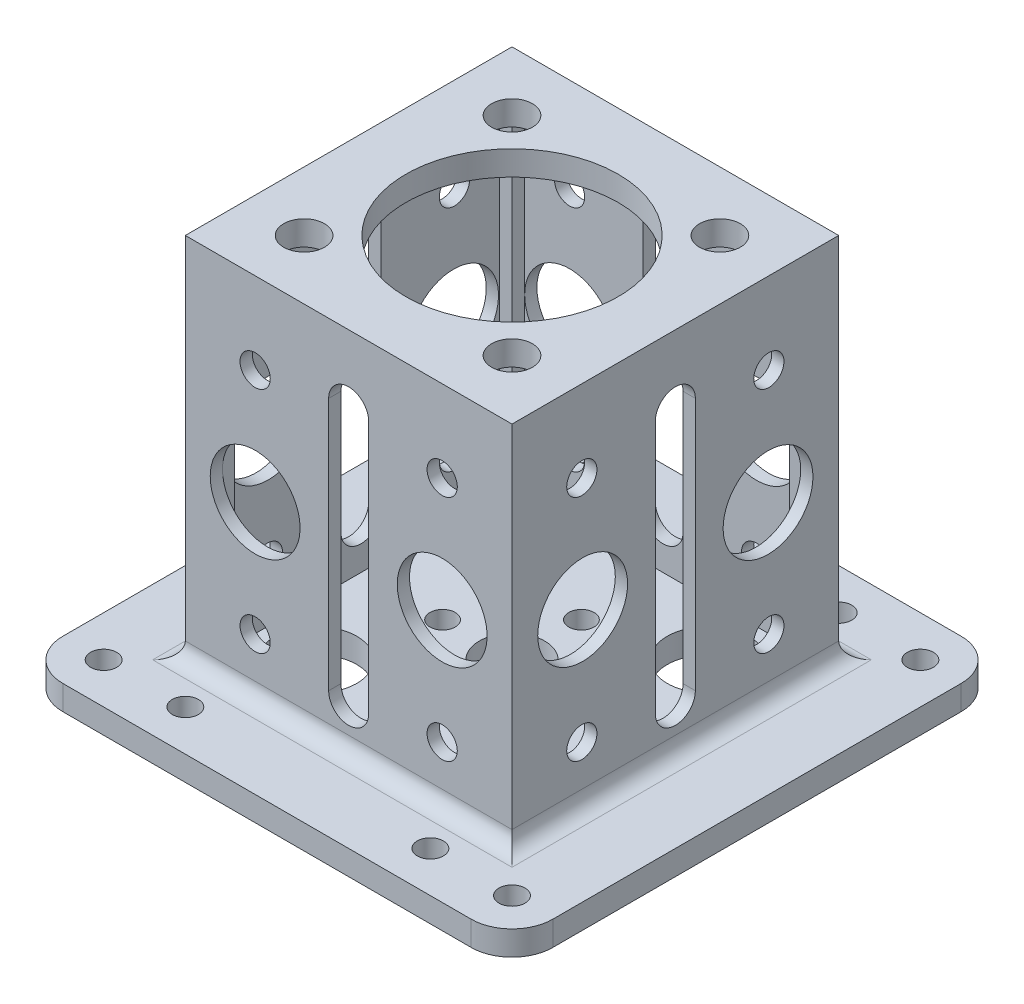
from build123d import *

# Parameters (mm, degrees)
SKETCH_1_W                = 40
SKETCH_1_H                = 40
SKETCH_1_R                = 1.55
EXTRUDE_2_DEPTH           = 3
SKETCH_1_6_R              = 4
CUT_EXTRUDE_1_DEPTH       = 1.5
SKETCH_2_W                = 3
SKETCH_2_H                = 3
EXTRUDE_7_DEPTH           = 45
SKETCH_5_W                = 40
SKETCH_5_H                = 3
EXTRUDE_8_DEPTH           = 40
CUT_EXTRUDE_2_DEPTH       = 4
CUT_EXTRUDE_START         = -4
SKETCH_7_R                = 4
CUT_EXTRUDE_3_DEPTH       = 4
SKETCH_8_R                = 5
CUT_EXTRUDE_4_DEPTH       = 4
SKETCH_9_R                = 2.5
CUT_EXTRUDE_5_DEPTH       = 4
SKETCH_10_W               = 1.5
SKETCH_10_H               = 34
SKETCH_10_W_2             = 34
SKETCH_10_H_2             = 1.5
EXTRUDE_10_DEPTH          = 45
CUT_EXTRUDE_12_DEPTH      = 63.507999488
CUT_EXTRUDE_12_DEPTH_BACK = 4
CUT_EXTRUDE_13_DEPTH      = 4
CUT_EXTRUDE_13_DEPTH_BACK = 64.442887702
CUT_EXTRUDE_15_DEPTH      = 10
CUT_EXTRUDE_15_DEPTH_BACK = 64.442887702
SKETCH_24_5_R             = 1.85
SKETCH_24_5_R_2           = 5.5
CUT_EXTRUDE_16_DEPTH      = 10
CUT_EXTRUDE_16_DEPTH_BACK = 64.442887702
SKETCH_25_R               = 5.5
SKETCH_25_R_2             = 1.85
SKETCH_27_W               = 60
SKETCH_27_H               = 60
SKETCH_27_R               = 1.6
EXTRUDE_13_DEPTH          = 3
FILLET_1_R                = 2
FILLET_2_R                = 5
SKETCH_28_R               = 13
CUT_EXTRUDE_17_DEPTH      = 10


with BuildPart() as part:
    # 草图1 → 凸台-拉伸2 (new body)
    with BuildSketch(Plane(origin=(0, 0, 0), x_dir=(1, 0, 0), z_dir=(0, 1, 0))):
        Rectangle(SKETCH_1_W, SKETCH_1_H)
        with Locations((0, 8.5)):
            Circle(SKETCH_1_R, mode=Mode.SUBTRACT)
        with Locations((8.5, 0)):
            Circle(SKETCH_1_R, mode=Mode.SUBTRACT)
        with Locations((0, -8.5)):
            Circle(SKETCH_1_R, mode=Mode.SUBTRACT)
        with Locations((-8.5, 0)):
            Circle(SKETCH_1_R, mode=Mode.SUBTRACT)
    extrude(amount=-EXTRUDE_2_DEPTH)

    # 草图1<6> → 切除-拉伸1 (cut)
    with BuildSketch(Plane(origin=(0, 0, 0), x_dir=(1, 0, 0), z_dir=(0, 1, 0))):
        Circle(SKETCH_1_6_R)
    extrude(amount=-CUT_EXTRUDE_1_DEPTH, mode=Mode.SUBTRACT)

    # 草图2 → 凸台-拉伸7 (add)
    with BuildSketch(Plane(origin=(0, 0, 0), x_dir=(1, 0, 0), z_dir=(0, 1, 0))):
        with Locations((-18.5, -18.5)):
            Rectangle(SKETCH_2_W, SKETCH_2_H)
        with Locations((18.5, -18.5)):
            Rectangle(SKETCH_2_W, SKETCH_2_H)
        with Locations((-18.5, 18.5)):
            Rectangle(SKETCH_2_W, SKETCH_2_H)
        with Locations((18.5, 18.5)):
            Rectangle(SKETCH_2_W, SKETCH_2_H)
    extrude(amount=EXTRUDE_7_DEPTH)

    # 草图5 → 凸台-拉伸8 (add)
    with BuildSketch(Plane.ZY.offset(20)):
        with Locations((0, 43.5)):
            Rectangle(SKETCH_5_W, SKETCH_5_H)
    extrude(amount=-EXTRUDE_8_DEPTH)

    # 草图6 → 切除-拉伸2 (cut)
    with BuildSketch(Plane(origin=(0, 45, 0), x_dir=(1, 0, 0), z_dir=(0, 1, 0))):
        with BuildLine():
            ThreePointArc((12.5, 0), (-8.838834765, 8.838834765), (0, -12.5))
            ThreePointArc((0, -12.5), (8.838834765, -8.838834765), (12.5, 0))
        make_face()
    extrude(amount=-CUT_EXTRUDE_2_DEPTH, mode=Mode.SUBTRACT)

    # 草图7 → 切除-拉伸3 (cut)
    with BuildSketch(Plane.XZ.offset(3).offset(CUT_EXTRUDE_START)):
        Circle(SKETCH_7_R)
    extrude(amount=CUT_EXTRUDE_3_DEPTH, mode=Mode.SUBTRACT)

    # 草图8 → 切除-拉伸4 (cut)
    with BuildSketch(Plane.XZ.offset(3)):
        with Locations((-12, 12)):
            Circle(SKETCH_8_R)
        with Locations((12, 12)):
            Circle(SKETCH_8_R)
        with Locations((12, -12)):
            Circle(SKETCH_8_R)
        with Locations((-12, -12)):
            Circle(SKETCH_8_R)
    extrude(amount=-CUT_EXTRUDE_4_DEPTH, mode=Mode.SUBTRACT)

    # 草图9 → 切除-拉伸5 (cut)
    with BuildSketch(Plane(origin=(0, 45, 0), x_dir=(1, 0, 0), z_dir=(0, 1, 0))):
        with Locations((-12.727922061, 12.727922061)):
            Circle(SKETCH_9_R)
        with Locations((12.727922061, 12.727922061)):
            Circle(SKETCH_9_R)
        with Locations((12.727922061, -12.727922061)):
            Circle(SKETCH_9_R)
        with Locations((-12.727922061, -12.727922061)):
            Circle(SKETCH_9_R)
    extrude(amount=-CUT_EXTRUDE_5_DEPTH, mode=Mode.SUBTRACT)

    # 草图10 → 凸台-拉伸10 (add)
    with BuildSketch(Plane(origin=(0, 0, 0), x_dir=(1, 0, 0), z_dir=(0, 1, 0))):
        with Locations((19.25, 0)):
            Rectangle(SKETCH_10_W, SKETCH_10_H)
        with Locations((0, -19.25)):
            Rectangle(SKETCH_10_W_2, SKETCH_10_H_2)
        with Locations((-19.25, 0)):
            Rectangle(SKETCH_10_W, SKETCH_10_H)
        with Locations((0, 19.25)):
            Rectangle(SKETCH_10_W_2, SKETCH_10_H_2)
    extrude(amount=EXTRUDE_10_DEPTH)

    # 草图20 → 切除-拉伸12 (cut, two sides: drawn at the far end of the back side and taken through both)
    with BuildSketch(Plane(origin=(0, 0, 18.5), x_dir=(-1, 0, 0), z_dir=(0, 0, -1)).offset(-CUT_EXTRUDE_12_DEPTH_BACK)):
        with BuildLine():
            Line((-2.45, 36.5), (-2.45, 5.5))
            ThreePointArc((-2.45, 5.5), (0, 3.05), (2.45, 5.5))
            Line((2.45, 5.5), (2.45, 36.5))
            ThreePointArc((2.45, 36.5), (0, 38.95), (-2.45, 36.5))
        make_face()
    extrude(amount=CUT_EXTRUDE_12_DEPTH + CUT_EXTRUDE_12_DEPTH_BACK, mode=Mode.SUBTRACT)

    # 草图24 → 切除-拉伸13 (cut, two sides: drawn at the far end of the back side and taken through both)
    with BuildSketch(Plane(origin=(20, 0, 0), x_dir=(0, 0, -1), z_dir=(1, 0, 0)).offset(-CUT_EXTRUDE_13_DEPTH_BACK)):
        with BuildLine():
            Line((-2.45, 36.5), (-2.45, 5.5))
            ThreePointArc((-2.45, 5.5), (0, 3.05), (2.45, 5.5))
            Line((2.45, 5.5), (2.45, 36.5))
            ThreePointArc((2.45, 36.5), (0, 38.95), (-2.45, 36.5))
        make_face()
    extrude(amount=CUT_EXTRUDE_13_DEPTH + CUT_EXTRUDE_13_DEPTH_BACK, mode=Mode.SUBTRACT)

    # 草图24<5> → 切除-拉伸15 (cut, two sides: drawn at the far end of the back side and taken through both)
    with BuildSketch(Plane(origin=(20, 0, 0), x_dir=(0, 0, -1), z_dir=(1, 0, 0)).offset(-CUT_EXTRUDE_15_DEPTH_BACK)):
        with Locations((-11.45, 35)):
            Circle(SKETCH_24_5_R)
        with Locations((-11.45, 7)):
            Circle(SKETCH_24_5_R)
        with Locations((11.45, 7)):
            Circle(SKETCH_24_5_R)
        with Locations((11.45, 35)):
            Circle(SKETCH_24_5_R)
        with Locations((-11.35, 21)):
            Circle(SKETCH_24_5_R_2)
        with Locations((11.35, 21)):
            Circle(SKETCH_24_5_R_2)
    extrude(amount=CUT_EXTRUDE_15_DEPTH + CUT_EXTRUDE_15_DEPTH_BACK, mode=Mode.SUBTRACT)

    # 草图25 → 切除-拉伸16 (cut, two sides: drawn at the far end of the back side and taken through both)
    with BuildSketch(Plane(origin=(0, 0, -20), x_dir=(-1, 0, 0), z_dir=(0, 0, -1)).offset(-CUT_EXTRUDE_16_DEPTH_BACK)):
        with Locations((-11.45, 21)):
            Circle(SKETCH_25_R)
        with Locations((-11.45, 35)):
            Circle(SKETCH_25_R_2)
        with Locations((11.45, 35)):
            Circle(SKETCH_25_R_2)
        with Locations((11.45, 7)):
            Circle(SKETCH_25_R_2)
        with Locations((-11.45, 7)):
            Circle(SKETCH_25_R_2)
        with Locations((11.45, 21)):
            Circle(SKETCH_25_R)
    extrude(amount=CUT_EXTRUDE_16_DEPTH + CUT_EXTRUDE_16_DEPTH_BACK, mode=Mode.SUBTRACT)

    # 草图27 → 凸台-拉伸13 (add)
    with BuildSketch(Plane.XZ.offset(3)):
        Rectangle(SKETCH_27_W, SKETCH_27_H)
        with Locations((-15, -25)):
            Circle(SKETCH_27_R, mode=Mode.SUBTRACT)
        with Locations((15, -25)):
            Circle(SKETCH_27_R, mode=Mode.SUBTRACT)
        with Locations((25, -25)):
            Circle(SKETCH_27_R, mode=Mode.SUBTRACT)
        with Locations((25, 25)):
            Circle(SKETCH_27_R, mode=Mode.SUBTRACT)
        with Locations((15, 25)):
            Circle(SKETCH_27_R, mode=Mode.SUBTRACT)
        with Locations((-15, 25)):
            Circle(SKETCH_27_R, mode=Mode.SUBTRACT)
        with Locations((-25, 25)):
            Circle(SKETCH_27_R, mode=Mode.SUBTRACT)
        with Locations((-25, -25)):
            Circle(SKETCH_27_R, mode=Mode.SUBTRACT)
        Polygon((-10, 20), (20, 20), (20, -20), (-20, -20), (-20, 20), align=None, mode=Mode.SUBTRACT)
    extrude(amount=-EXTRUDE_13_DEPTH)

    # 圆角1
    fillet_1_edges = [part.edges().sort_by_distance(p)[0] for p in [
        (0, 0, 20),
        (-20, 0, 0),
        (20, 0, 0),
        (0, 0, -20),
    ]]
    fillet(fillet_1_edges, radius=FILLET_1_R)

    # 圆角2
    fillet_2_edges = [part.edges().sort_by_distance(p)[0] for p in [
        (-30, -1.5, 30),
        (30, -1.5, 30),
        (30, -1.5, -30),
        (-30, -1.5, -30),
    ]]
    fillet(fillet_2_edges, radius=FILLET_2_R)

    # 草图28 → 切除-拉伸17 (cut)
    with BuildSketch(Plane(origin=(0, 45, 0), x_dir=(1, 0, 0), z_dir=(0, 1, 0))):
        Circle(SKETCH_28_R)
    extrude(amount=-CUT_EXTRUDE_17_DEPTH, mode=Mode.SUBTRACT)


solid = part.part
